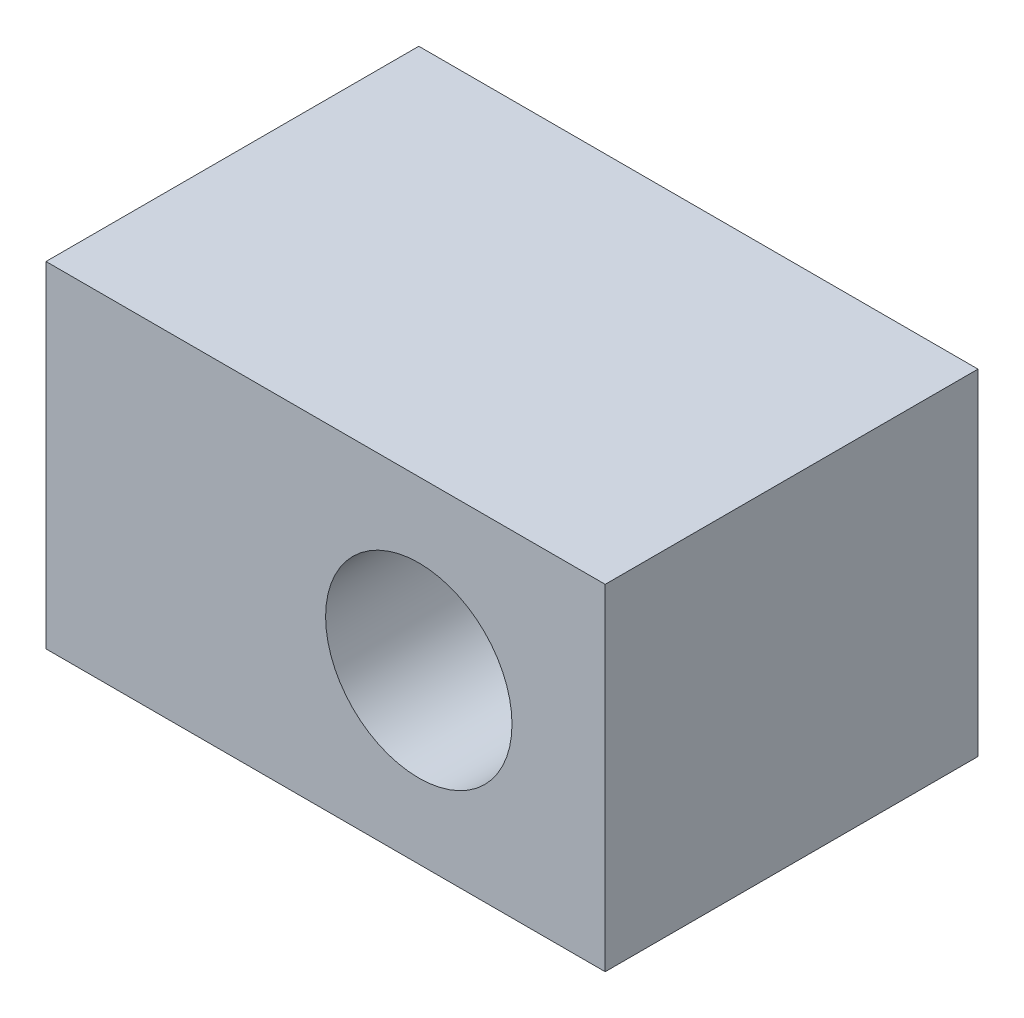
from build123d import *

# Parameters (mm, degrees)
SKETCH1_W                  = 19.05
SKETCH1_H                  = 11.43
BOSS_EXTRUDE1_DEPTH        = 12.7
SKETCH3_R                  = 3.175
CUT_EXTRUDE1_DEPTH         = 17.872369425
F_10_32_TAPPED_HOLE3_D     = 4.0386
F_10_32_TAPPED_HOLE3_DEPTH = 7.45744
F_10_32_TAPPED_HOLE3_TIP   = 1.213317848


with BuildPart() as part:
    # Sketch1 → Boss-Extrude1 (new body)
    with BuildSketch(Plane.XY):
        Rectangle(SKETCH1_W, SKETCH1_H)
    extrude(amount=BOSS_EXTRUDE1_DEPTH)

    # Sketch3 → Cut-Extrude1 (cut, through all)
    with BuildSketch(Plane.XY.offset(12.7)):
        with Locations((3.175, 0)):
            Circle(SKETCH3_R)
    extrude(amount=-CUT_EXTRUDE1_DEPTH, mode=Mode.SUBTRACT)

    # #10-32 Tapped Hole3
    with Locations(Plane(origin=(-9.525, 0, 6.35), x_dir=(0, 0, -1), z_dir=(-1, 0, 0))):
        with Locations((0, 0)):
            Hole(F_10_32_TAPPED_HOLE3_D / 2, depth=F_10_32_TAPPED_HOLE3_DEPTH)
            with Locations((0, 0, -(F_10_32_TAPPED_HOLE3_DEPTH + F_10_32_TAPPED_HOLE3_TIP / 2))):  # 118° drill point
                Cone(0, F_10_32_TAPPED_HOLE3_D / 2, F_10_32_TAPPED_HOLE3_TIP, mode=Mode.SUBTRACT)


solid = part.part
